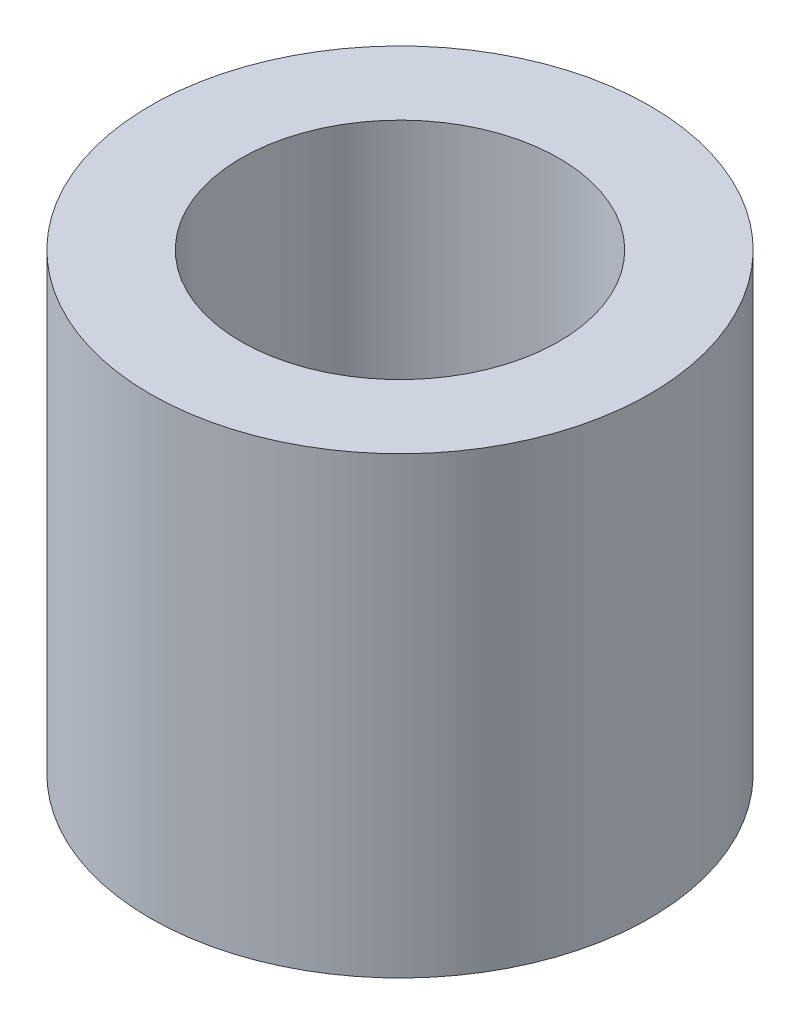
from build123d import *

# Parameters (mm, degrees)
SKETCH_1_R      = 2.75
SKETCH_1_R_2    = 1.75
EXTRUDE_1_DEPTH = 5


with BuildPart() as part:
    # 草图1 → 凸台-拉伸1 (new body)
    with BuildSketch(Plane(origin=(0, 0, 0), x_dir=(1, 0, 0), z_dir=(0, 1, 0))):
        with Locations(Location((0, 0, 0), (0, 0, 270))):
            Circle(SKETCH_1_R)
        with Locations(Location((0, 0, 0), (0, 0, 270))):
            Circle(SKETCH_1_R_2, mode=Mode.SUBTRACT)
    extrude(amount=EXTRUDE_1_DEPTH)


solid = part.part
